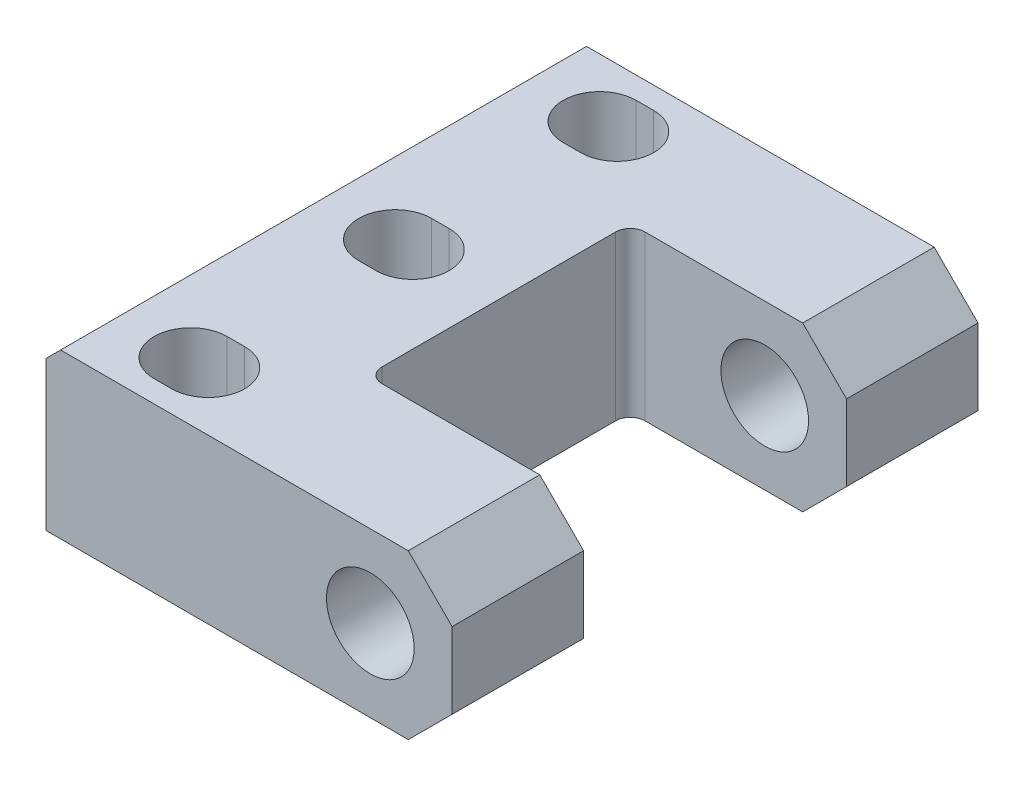
from build123d import *

# Parameters (mm, degrees)
EXTRUDE_1_DEPTH        = 56
CUT_EXTRUDE_1_REACH    = 176.806
CUT_EXTRUDE_2_DEPTH    = 24
PATTERN_LINEAR_1_COUNT = 3
PATTERN_LINEAR_1_PITCH = 70
SKETCH_4_R             = 15
CUT_EXTRUDE_3_DEPTH    = 235.215712539
CHAMFER_1_SIZE         = 5
CHAMFER_2_SIZE         = 15
FILLET_1_R             = 5


with BuildPart() as part:
    # 草图1 → 凸台-拉伸1 (new body)
    with BuildSketch(Plane(origin=(0, 0, 0), x_dir=(1, 0, 0), z_dir=(0, 1, 0))):
        Polygon((0, -90), (0, 90), (139, 90), (139, 45), (65, 45), (65, -45), (139, -45), (139, -90), align=None)
    extrude(amount=-EXTRUDE_1_DEPTH)

    # 草图2 → 切除-拉伸1 (cut, up to next)
    with BuildSketch(Plane(origin=(0, 0, 0), x_dir=(1, 0, 0), z_dir=(0, 1, 0)), mode=Mode.PRIVATE) as cut_extrude_1_sk1:
        with BuildLine():
            Line((29.5, 78.5), (35.5, 78.5))
            ThreePointArc((35.5, 78.5), (44, 70), (35.5, 61.5))
            Line((35.5, 61.5), (29.5, 61.5))
            ThreePointArc((29.5, 61.5), (21, 70), (29.5, 78.5))
        make_face()
    cut_extrude_1_tool1 = extrude(cut_extrude_1_sk1.sketch, amount=-CUT_EXTRUDE_1_REACH, mode=Mode.PRIVATE) & part.part
    cut_extrude_1 = cut_extrude_1_tool1.solids().sort_by_distance((32.5, 0, -70))[0]
    add(cut_extrude_1, mode=Mode.SUBTRACT)

    # 草图3 → 切除-拉伸2 (cut)
    with BuildSketch(Plane(origin=(0, 0, 0), x_dir=(1, 0, 0), z_dir=(0, 1, 0))):
        with BuildLine():
            Line((29.5, 57.5), (35.5, 57.5))
            ThreePointArc((35.5, 57.5), (48, 70), (35.5, 82.5))
            Line((35.5, 82.5), (29.5, 82.5))
            ThreePointArc((29.5, 82.5), (17, 70), (29.5, 57.5))
        make_face()
    cut_extrude_2 = extrude(amount=-CUT_EXTRUDE_2_DEPTH, mode=Mode.SUBTRACT)

    # 阵列(线性)1: 切除-拉伸1, 切除-拉伸2 ×3
    with Locations(*[(0, 0, i * PATTERN_LINEAR_1_PITCH) for i in range(1, PATTERN_LINEAR_1_COUNT)]):
        add(cut_extrude_1, mode=Mode.SUBTRACT)
        add(cut_extrude_2, mode=Mode.SUBTRACT)

    # 草图4 → 切除-拉伸3 (cut, through all)
    with BuildSketch(Plane.XY.offset(90)):
        with Locations((111, -28)):
            Circle(SKETCH_4_R)
    extrude(amount=-CUT_EXTRUDE_3_DEPTH, mode=Mode.SUBTRACT)

    # 倒角1
    chamfer_1_edges = [part.edges().sort_by_distance(p)[0] for p in [
        (0, 0, 0),
    ]]
    chamfer(chamfer_1_edges, length=CHAMFER_1_SIZE)

    # 倒角2
    chamfer_2_edges = [part.edges().sort_by_distance(p)[0] for p in [
        (139, -56, 67.5),
        (139, -56, -67.5),
        (139, 0, -67.5),
        (139, 0, 67.5),
    ]]
    chamfer(chamfer_2_edges, length=CHAMFER_2_SIZE)

    # 圆角1
    fillet_1_edges = [part.edges().sort_by_distance(p)[0] for p in [
        (65, -28, -45),
        (65, -28, 45),
    ]]
    fillet(fillet_1_edges, radius=FILLET_1_R)


solid = part.part
